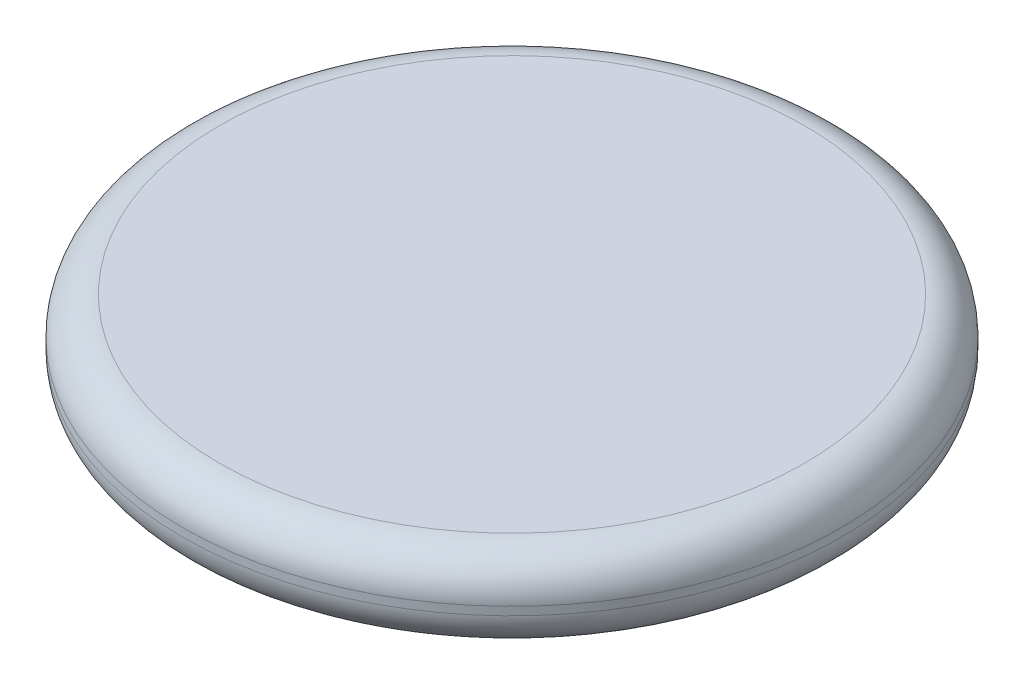
from build123d import *

# Parameters (mm, degrees)
SKETCH1_R           = 101.6
BOSS_EXTRUDE2_DEPTH = 25.4
FILLET1_R           = 11.43


with BuildPart() as part:
    # Sketch1 → Boss-Extrude2 (new body)
    with BuildSketch(Plane(origin=(0, 0, 0), x_dir=(1, 0, 0), z_dir=(0, 1, 0))):
        with Locations(Location((0, 381, 0), (0, 0, 270))):
            Circle(SKETCH1_R)
    extrude(amount=BOSS_EXTRUDE2_DEPTH)

    # Fillet1
    fillet1_edges = [part.edges().sort_by_distance(p)[0] for p in [
        (0, 0, -482.6),
        (0, 25.4, -482.6),
    ]]
    fillet(fillet1_edges, radius=FILLET1_R)


solid = part.part
